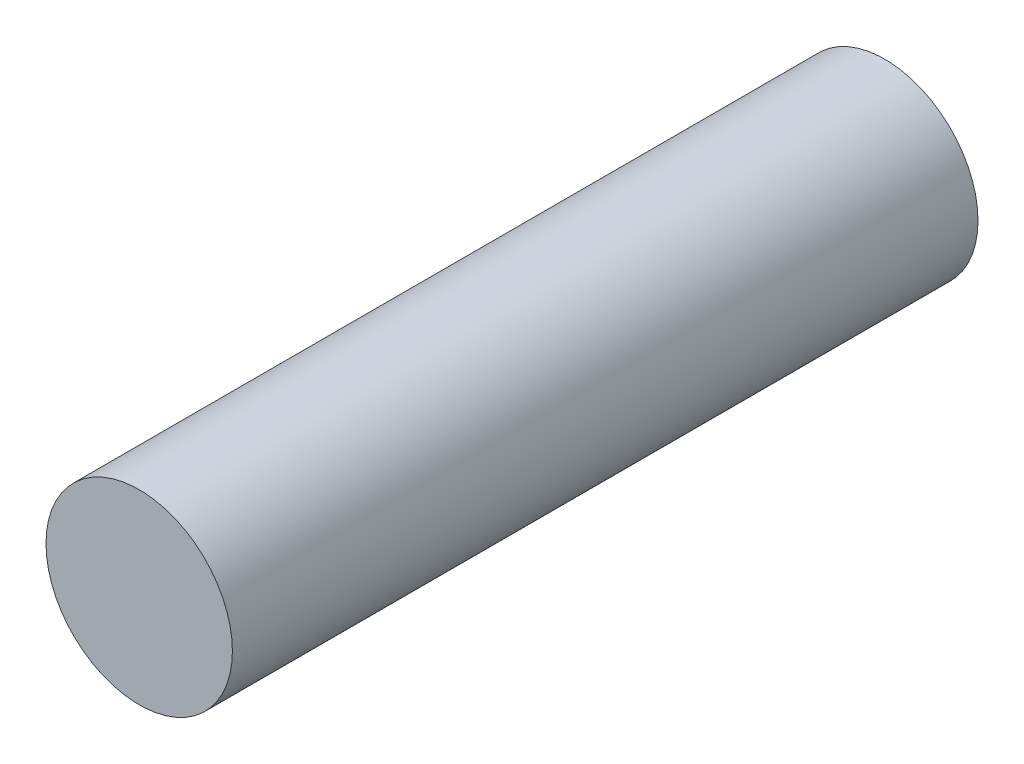
from build123d import *

# Parameters (mm, degrees)
SKETCH1_R           = 500
BOSS_EXTRUDE1_DEPTH = 2000


with BuildPart() as part:
    # Sketch1 → Boss-Extrude1 (new, symmetric)
    with BuildSketch(Plane.XY):
        Circle(SKETCH1_R)
    extrude(amount=BOSS_EXTRUDE1_DEPTH, both=True)


solid = part.part
